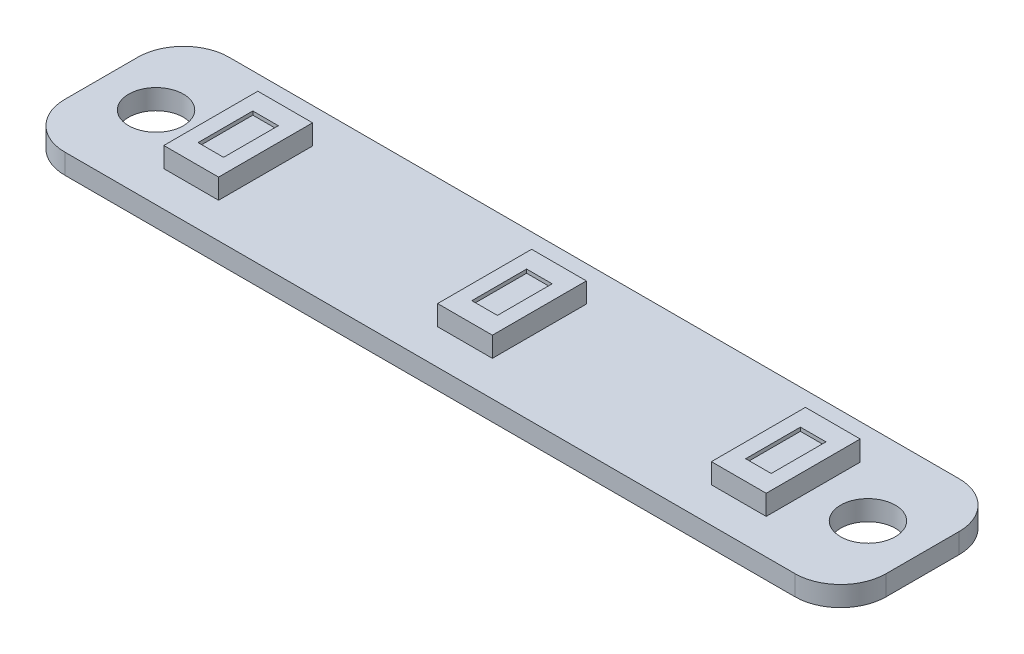
from build123d import *

# Parameters (mm, degrees)
SKETCH1_R           = 1.5
BOSS_EXTRUDE1_DEPTH = 1.1
SKETCH2_W           = 3
SKETCH2_H           = 5.15
BOSS_EXTRUDE2_DEPTH = 1.1
SKETCH3_W           = 1.4
SKETCH3_H           = 3
CUT_EXTRUDE1_DEPTH  = 0.2


with BuildPart() as part:
    # Sketch1 → Boss-Extrude1 (new body)
    with BuildSketch(Plane(origin=(0, 0, 0), x_dir=(1, 0, 0), z_dir=(0, 1, 0))):
        with BuildLine():
            Line((-20, 4.5), (20, 4.5))
            ThreePointArc((20, 4.5), (21.767766953, 3.767766953), (22.5, 2))
            Line((22.5, 2), (22.5, -2))
            ThreePointArc((22.5, -2), (21.767766953, -3.767766953), (20, -4.5))
            Line((20, -4.5), (-20, -4.5))
            ThreePointArc((-20, -4.5), (-21.767766953, -3.767766953), (-22.5, -2))
            Line((-22.5, -2), (-22.5, 2))
            ThreePointArc((-22.5, 2), (-21.767766953, 3.767766953), (-20, 4.5))
        make_face()
        with Locations(Location((-19.5, 0, 0), (0, 0, 270))):
            Circle(SKETCH1_R, mode=Mode.SUBTRACT)
        with Locations(Location((19.5, 0, 0), (0, 0, 90))):
            Circle(SKETCH1_R, mode=Mode.SUBTRACT)
    extrude(amount=BOSS_EXTRUDE1_DEPTH)

    # Sketch2 → Boss-Extrude2 (add)
    with BuildSketch(Plane(origin=(0, 1.1, 0), x_dir=(1, 0, 0), z_dir=(0, 1, 0))):
        with Locations((15, 0)):
            Rectangle(SKETCH2_W, SKETCH2_H)
        with Locations((-15, 0)):
            Rectangle(SKETCH2_W, SKETCH2_H)
        Rectangle(SKETCH2_W, SKETCH2_H)
    extrude(amount=BOSS_EXTRUDE2_DEPTH)

    # Sketch3 → Cut-Extrude1 (cut)
    with BuildSketch(Plane(origin=(0, 2.2, 0), x_dir=(1, 0, 0), z_dir=(0, 1, 0))):
        with Locations((15, 0)):
            Rectangle(SKETCH3_W, SKETCH3_H)
        with Locations((-15, 0)):
            Rectangle(SKETCH3_W, SKETCH3_H)
        Rectangle(SKETCH3_W, SKETCH3_H)
    extrude(amount=-CUT_EXTRUDE1_DEPTH, mode=Mode.SUBTRACT)


solid = part.part
